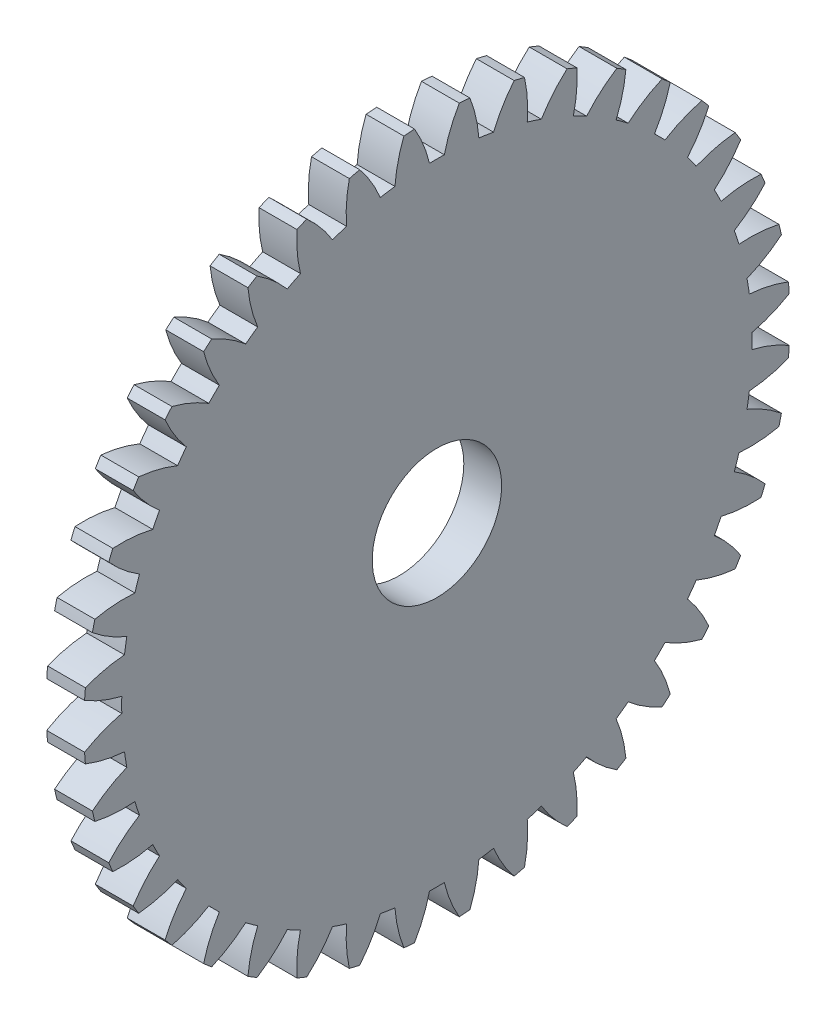
from build123d import *

# Parameters (mm, degrees)
BASPROSKE_W        = 4.5
BASPROSKE_H        = 42
TOOTHCUT_DEPTH     = 60.567188955
TEETHCUTS_COUNT    = 40
TEETHCUTS_ANGLE    = 351
BORSKE_R           = 5
BORE_DEPTH         = 50.0000508
SKETCH1_R          = 7.7
CUT_EXTRUDE1_DEPTH = 60.447932774


with BuildPart() as part:
    # BasProSke → Base-Revolve (revolve)
    with BuildSketch(Plane(origin=(0, 0, 0), x_dir=(1, 0, 0), z_dir=(0, 1, 0)), mode=Mode.PRIVATE) as base_revolve_sk:
        with Locations((2.25, 21)):
            Rectangle(BASPROSKE_W, BASPROSKE_H)
    revolve(base_revolve_sk.sketch.rotate(Axis((-10, 0, 0), (1, 0, 0)), 180), axis=Axis((-10, 0, 0), (1, 0, 0)))

    # TooCutSke → ToothCut (cut, through all)
    with BuildSketch(Plane(origin=(0, 0, 0), x_dir=(0, 0, -1), z_dir=(1, 0, 0))):
        with BuildLine():
            ThreePointArc((0.882812088, 37.488606854), (0, 37.499), (-0.882812088, 37.488606854))
            ThreePointArc((-0.882812088, 37.488606854), (-1.612748684, 39.782000434), (-2.678427154, 41.939960338))
            ThreePointArc((-2.678427154, 41.939960338), (0, 42.0254), (2.678427154, 41.939960338))
            ThreePointArc((2.678427154, 41.939960338), (1.612748684, 39.782000434), (0.882812088, 37.488606854))
        make_face()
    toothcut = extrude(amount=TOOTHCUT_DEPTH, mode=Mode.SUBTRACT)

    # TeethCuts: ToothCut ×40 about axis
    teethcuts_axis = Axis((-10, 0, 0), (1, 0, 0))
    for i in range(1, TEETHCUTS_COUNT):
        add(toothcut.rotate(teethcuts_axis, i * TEETHCUTS_ANGLE / (TEETHCUTS_COUNT - 1)), mode=Mode.SUBTRACT)

    # BorSke → Bore (cut, symmetric)
    with BuildSketch(Plane(origin=(0, 0, 0), x_dir=(0, 0, -1), z_dir=(1, 0, 0))):
        with Locations(Location((0, 0, 0), (0, 0, 180))):
            Circle(BORSKE_R)
    extrude(amount=BORE_DEPTH, both=True, mode=Mode.SUBTRACT)

    # Sketch1 → Cut-Extrude1 (cut, through all)
    with BuildSketch(Plane(origin=(4.5, 0, 0), x_dir=(0, 0, -1), z_dir=(1, 0, 0))):
        Circle(SKETCH1_R)
    extrude(amount=-CUT_EXTRUDE1_DEPTH, mode=Mode.SUBTRACT)


solid = part.part
